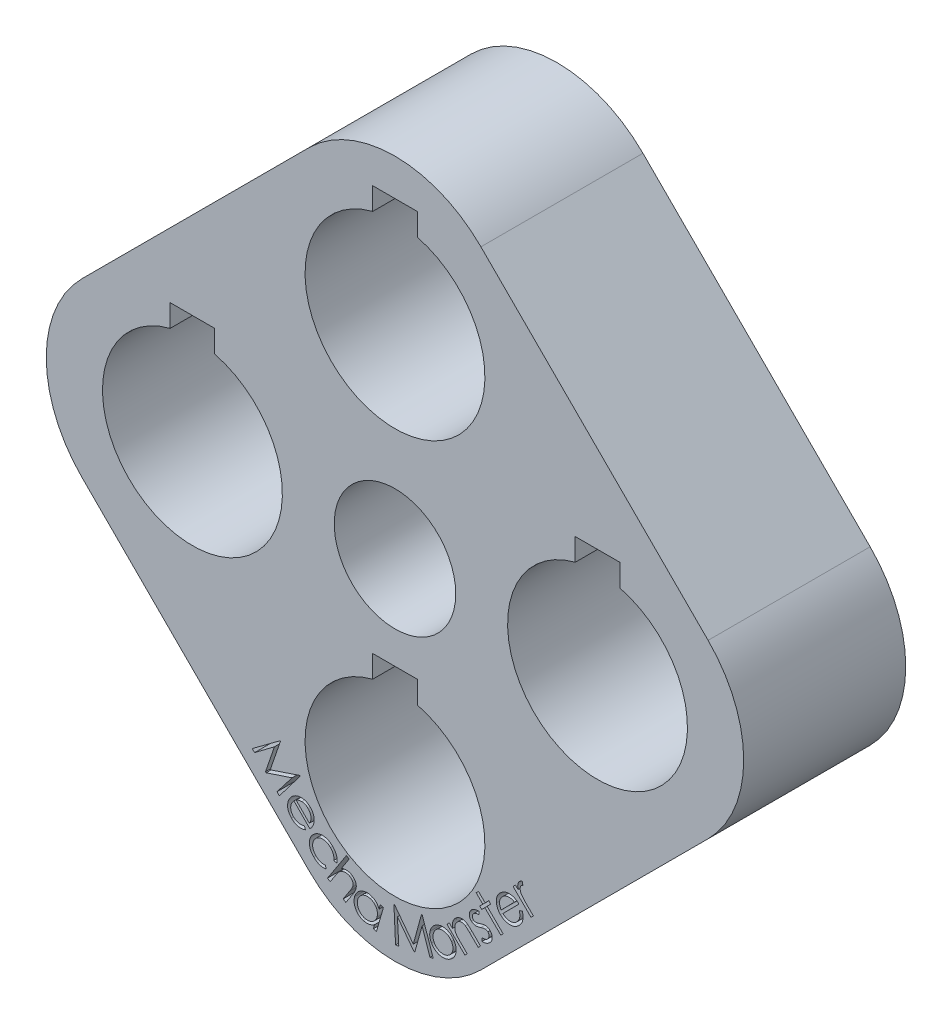
from build123d import *

# Parameters (mm, degrees)
SKETCH1_R           = 7.5
BOSS_EXTRUDE1_DEPTH = 20
FILLET1_R           = 15
CUT_EXTRUDE4_DEPTH  = 3


with BuildPart() as part:
    # Sketch1 → Boss-Extrude1 (new body)
    with BuildSketch(Plane.XY):
        Polygon((0, -24.255339059), (49.255339059, 25), (0, 74.255339059), (-49.255339059, 25), align=None)
        with Locations((0, 25)):
            Circle(SKETCH1_R, mode=Mode.SUBTRACT)
        with BuildLine():
            Line((-2.75, 13.503952762), (2.75, 13.503952762))
            Line((2.75, 13.503952762), (2.75, 10.753952762))
            ThreePointArc((2.75, 10.753952762), (0, -11.1), (-2.75, 10.753952762))
            Line((-2.75, 10.753952762), (-2.75, 13.503952762))
        make_face(mode=Mode.SUBTRACT)
        with BuildLine():
            Line((-2.75, 63.503952762), (2.75, 63.503952762))
            Line((2.75, 63.503952762), (2.75, 60.753952762))
            ThreePointArc((2.75, 60.753952762), (0, 38.9), (-2.75, 60.753952762))
            Line((-2.75, 60.753952762), (-2.75, 63.503952762))
        make_face(mode=Mode.SUBTRACT)
        with BuildLine():
            Line((22.25, 38.503952762), (27.75, 38.503952762))
            Line((27.75, 38.503952762), (27.75, 35.753952762))
            ThreePointArc((27.75, 35.753952762), (25, 13.9), (22.25, 35.753952762))
            Line((22.25, 35.753952762), (22.25, 38.503952762))
        make_face(mode=Mode.SUBTRACT)
        with BuildLine():
            Line((-27.75, 38.503952762), (-22.25, 38.503952762))
            Line((-22.25, 38.503952762), (-22.25, 35.753952762))
            ThreePointArc((-22.25, 35.753952762), (-25, 13.9), (-27.75, 35.753952762))
            Line((-27.75, 35.753952762), (-27.75, 38.503952762))
        make_face(mode=Mode.SUBTRACT)
    extrude(amount=BOSS_EXTRUDE1_DEPTH)

    # Fillet1
    fillet1_edges = [part.edges().sort_by_distance(p)[0] for p in [
        (49.255339059, 25, 10),
        (0, -24.255339059, 10),
        (-49.255339059, 25, 10),
        (0, 74.255339059, 10),
    ]]
    fillet(fillet1_edges, radius=FILLET1_R)

    # Sketch4 → Cut-Extrude4 (cut)
    # profile 1 of 12: a face of its own
    with BuildSketch(Plane.XY.offset(20)):
        with BuildLine():
            Line((14.57196407, -2.731870868), (14.861140085, -2.440150782))
            Line((14.861140085, -2.440150782), (15.185933087, -2.76155169))
            add(Edge.make_bspline(
                [(15.185933087, -2.76155169), (15.176864041, -2.709944276), (15.159352125, -2.610292703), (15.148158741, -2.464651139), (15.150912394, -2.329021108), (15.168497698, -2.203696367), (15.199934358, -2.088284076), (15.243886591, -1.982892846), (15.302035886, -1.887547489), (15.351239717, -1.833104568), (15.375890352, -1.805829201)],
                knots=[0, 0, 0, 0, 1.238328021, 2.391155128, 3.447473944, 4.439911283, 5.375446952, 6.267952662, 7.13226135, 8, 8, 8, 8], degree=3))
            add(Edge.make_bspline(
                [(15.375890352, -1.805829201), (15.396873142, -1.786818486), (15.44003116, -1.747716688), (15.516892742, -1.699561468), (15.604820904, -1.6587985), (15.668480419, -1.638357099), (15.701531378, -1.627744265)],
                knots=[0, 0, 0, 0, 0.904958139, 1.861344476, 2.889645698, 4, 4, 4, 4], degree=3))
            Line((15.701531378, -1.627744265), (15.795661987, -2.015291007))
            add(Edge.make_bspline(
                [(15.795661987, -2.015291007), (15.775770093, -2.023819438), (15.737980038, -2.04002151), (15.68608396, -2.066553583), (15.642938184, -2.095552625), (15.618784965, -2.117082418), (15.607400769, -2.127230109)],
                knots=[0, 0, 0, 0, 1.178648847, 2.239163524, 3.170060605, 4, 4, 4, 4], degree=3))
            add(Edge.make_bspline(
                [(15.607400769, -2.127230109), (15.585366617, -2.15243007), (15.540628807, -2.20359569), (15.49303485, -2.297659168), (15.463519927, -2.404506583), (15.450218985, -2.501105121), (15.450710494, -2.583555193), (15.455316134, -2.648910264), (15.467778152, -2.716329539), (15.485824506, -2.785582462), (15.508390511, -2.857307624), (15.538832047, -2.930283339), (15.574088797, -3.00577894), (15.601724663, -3.055689899), (15.615881004, -3.081256551)],
                knots=[0, 0, 0, 0, 1.172895077, 2.381428413, 3.664118173, 5.056485402, 5.791607531, 6.558850648, 7.35587122, 8.196754804, 9.073265227, 9.995638265, 10.973275174, 12, 12, 12, 12], degree=3))
            add(Edge.make_bspline(
                [(15.615881004, -3.081256551), (15.629527464, -3.103155664), (15.659686173, -3.151552753), (15.71412476, -3.227810687), (15.78373411, -3.313434675), (15.866722195, -3.409491318), (15.962689209, -3.516510671), (16.072280437, -3.633666673), (16.196148772, -3.760578027), (16.284006203, -3.847986883), (16.329916795, -3.893663068)],
                knots=[0, 0, 0, 0, 0.571285428, 1.262542128, 2.072931178, 3.013920869, 4.073308893, 5.255733602, 6.565962005, 8, 8, 8, 8], degree=3))
            Line((16.329916795, -3.893663068), (17.081265619, -4.637379682))
            Line((17.081265619, -4.637379682), (16.792089604, -4.929099767))
            Line((16.792089604, -4.929099767), (14.57196407, -2.731870868))
        make_face()
    # profile 2 of 12: a face of its own
    with BuildSketch(Plane.XY.offset(20)):
        with BuildLine():
            Line((15.342801074, -4.922237854), (15.707451181, -4.807754681))
            add(Edge.make_bspline(
                [(15.707451181, -4.807754681), (15.725102852, -4.86459139), (15.759369503, -4.974926767), (15.793281882, -5.140161787), (15.811571367, -5.298827496), (15.814270234, -5.451352583), (15.802308389, -5.598742733), (15.77647881, -5.741701144), (15.738688653, -5.881759353), (15.685272985, -6.017744938), (15.619301932, -6.15140057), (15.535418017, -6.280460789), (15.438474501, -6.408603754), (15.362850977, -6.487839239), (15.324144557, -6.528394371)],
                knots=[0, 0, 0, 0, 1.147063421, 2.226759362, 3.247046854, 4.222874512, 5.163510201, 6.093727941, 7.020698111, 7.956012273, 8.906701803, 9.889552677, 10.919808848, 12, 12, 12, 12], degree=3))
            add(Edge.make_bspline(
                [(15.324144557, -6.528394371), (15.279359014, -6.57132225), (15.191939666, -6.65511552), (15.051572122, -6.764441376), (14.906513847, -6.853908889), (14.758265613, -6.925794753), (14.606284541, -6.980051137), (14.449940547, -7.014957612), (14.289660216, -7.031182581), (14.127622769, -7.027884547), (13.96755241, -7.009549443), (13.811764146, -6.980738386), (13.662967225, -6.936932119), (13.520626454, -6.881487634), (13.383996759, -6.814796102), (13.255242069, -6.733334551), (13.13182852, -6.641158052), (13.056989411, -6.57016307), (13.019216673, -6.534330535)],
                knots=[0, 0, 0, 0, 1.154621885, 2.253769481, 3.305465943, 4.322436967, 5.316275864, 6.303359915, 7.297923306, 8.308623123, 9.314762543, 10.29542665, 11.254842703, 12.198067375, 13.13727433, 14.08071926, 15.031302072, 16, 16, 16, 16], degree=3))
            add(Edge.make_bspline(
                [(13.019216673, -6.534330535), (12.9851839, -6.499312082), (12.917744236, -6.429919186), (12.829210907, -6.316101974), (12.749517237, -6.198573027), (12.682681449, -6.074592281), (12.625366422, -5.946364725), (12.579544936, -5.812405858), (12.544267448, -5.673142749), (12.530215601, -5.577631861), (12.523122923, -5.529422683)],
                knots=[0, 0, 0, 0, 1.025246356, 2.031637833, 3.024905585, 4.005593486, 4.986712902, 5.972763272, 6.976751036, 8, 8, 8, 8], degree=3))
            add(Edge.make_bspline(
                [(12.523122923, -5.529422683), (12.517216945, -5.468427756), (12.505636057, -5.348824294), (12.51211521, -5.170596762), (12.537956074, -4.998517408), (12.585582097, -4.832488076), (12.651621303, -4.672112203), (12.73945432, -4.518542736), (12.846583478, -4.370776355), (12.931125815, -4.280541528), (12.974271427, -4.234490792)],
                knots=[0, 0, 0, 0, 1.032474824, 2.024554675, 2.998744837, 3.959973082, 4.930224934, 5.916458261, 6.936678512, 8, 8, 8, 8], degree=3))
            add(Edge.make_bspline(
                [(12.974271427, -4.234490792), (13.021094552, -4.189577763), (13.112880276, -4.101536331), (13.264244708, -3.990466239), (13.421112784, -3.898392715), (13.584938069, -3.827790439), (13.755048211, -3.776758128), (13.931767274, -3.748926557), (14.114743708, -3.738133708), (14.237867995, -3.748983334), (14.300580187, -3.754509488)],
                knots=[0, 0, 0, 0, 1.063125237, 2.084007013, 3.070791757, 4.040527219, 5.002797975, 5.975322074, 6.968749423, 8, 8, 8, 8], degree=3))
            add(Edge.make_bspline(
                [(14.300580187, -3.754509488), (14.345383992, -3.760782043), (14.435225611, -3.773359914), (14.567686377, -3.806662851), (14.696923357, -3.853234543), (14.824154846, -3.909899045), (14.948068516, -3.980072217), (15.069550008, -4.061868778), (15.188822155, -4.155192619), (15.26387338, -4.225150782), (15.302095946, -4.26077952)],
                knots=[0, 0, 0, 0, 0.949379018, 1.90371663, 2.861057541, 3.830645602, 4.824452431, 5.846650718, 6.903328567, 8, 8, 8, 8], degree=3))
            Line((15.302095946, -4.26077952), (13.327049205, -6.256178826))
            add(Edge.make_bspline(
                [(13.327049205, -6.256178826), (13.359913554, -6.286159814), (13.424578944, -6.345151771), (13.528331999, -6.422146826), (13.634562159, -6.48805087), (13.743783676, -6.541613532), (13.855171489, -6.584491698), (13.969691207, -6.615351488), (14.087119797, -6.633648932), (14.206076919, -6.641530069), (14.324233949, -6.637178438), (14.439560471, -6.621948563), (14.550718838, -6.595756784), (14.657825046, -6.55837272), (14.7596571, -6.508472797), (14.858074494, -6.448972551), (14.951788074, -6.377445584), (15.009194182, -6.322338346), (15.038360636, -6.294339884)],
                knots=[0, 0, 0, 0, 1.117684253, 2.19920645, 3.242444032, 4.25620018, 5.252573491, 6.238528758, 7.231526287, 8.235497616, 9.230958312, 10.198744758, 11.155327073, 12.096986603, 13.044073149, 14.000734639, 14.984228603, 16, 16, 16, 16], degree=3))
            add(Edge.make_bspline(
                [(15.038360636, -6.294339884), (15.065423242, -6.265372432), (15.119204751, -6.207805421), (15.191054305, -6.113922042), (15.252764065, -6.013108092), (15.306607944, -5.907920545), (15.351745759, -5.800427809), (15.384660364, -5.692006781), (15.407947807, -5.585144161), (15.420702807, -5.476058001), (15.419709128, -5.358969259), (15.407497044, -5.227908467), (15.381307449, -5.080131757), (15.356140767, -4.976936749), (15.342801074, -4.922237854)],
                knots=[0, 0, 0, 0, 0.962829226, 1.913430301, 2.86643511, 3.830953147, 4.782471826, 5.694941085, 6.579986032, 7.437059565, 8.357404625, 9.419476327, 10.632183882, 12, 12, 12, 12], degree=3))
        make_face()
        with BuildLine():
            add(Edge.make_bspline(
                [(14.744944504, -4.330317448), (14.698817566, -4.304127844), (14.610011008, -4.253705927), (14.473567277, -4.19748228), (14.343008828, -4.155946097), (14.215795339, -4.133739959), (14.0901298, -4.127365567), (13.963730838, -4.138219549), (13.835181167, -4.163872215), (13.706623632, -4.20471148), (13.58056932, -4.257910959), (13.462511716, -4.326945482), (13.350837683, -4.40610746), (13.284777994, -4.469105922), (13.251575113, -4.500770172)],
                knots=[0, 0, 0, 0, 1.169088622, 2.250804884, 3.248923354, 4.185992093, 5.091272184, 6.01723614, 6.977283851, 7.977251285, 8.988510715, 9.988633695, 10.989048259, 12, 12, 12, 12], degree=3))
            add(Edge.make_bspline(
                [(13.251575113, -4.500770172), (13.225525296, -4.527950725), (13.174180393, -4.58152434), (13.108545508, -4.670013278), (13.050042063, -4.76035796), (13.002652298, -4.855648163), (12.963003232, -4.953796569), (12.934867324, -5.056373639), (12.91328307, -5.161987442), (12.908170391, -5.234206502), (12.905581523, -5.270775514)],
                knots=[0, 0, 0, 0, 1.044877375, 2.059481962, 3.055066394, 4.031386489, 5.011331762, 5.990773466, 6.982603363, 8, 8, 8, 8], degree=3))
            add(Edge.make_bspline(
                [(12.905581523, -5.270775514), (12.905140531, -5.29792041), (12.904243283, -5.353149727), (12.911223973, -5.437185289), (12.926128215, -5.523236611), (12.947263734, -5.611741293), (12.976252384, -5.702400927), (13.012902161, -5.794986204), (13.057329728, -5.889301924), (13.091003665, -5.951890916), (13.10825914, -5.983963281)],
                knots=[0, 0, 0, 0, 0.86725268, 1.764522297, 2.689778832, 3.65606644, 4.670318369, 5.728864248, 6.836205956, 8, 8, 8, 8], degree=3))
            Line((13.10825914, -5.983963281), (14.744944504, -4.330317448))
        make_face(mode=Mode.SUBTRACT)
    # profile 3 of 12: a face of its own
    with BuildSketch(Plane.XY.offset(20)):
        Polygon((10.019349107, -5.686241718), (10.304285005, -5.398761751), (11.128563851, -6.214560362), (11.576320261, -5.76171581), (11.821399054, -6.004250533), (11.373642644, -6.457095084), (13.348689385, -8.411789261), (13.063753488, -8.699269229), (11.088706746, -6.744575052), (10.702856052, -7.134665864), (10.457777259, -6.892131142), (10.843627953, -6.50204033), align=None)
    # profile 4 of 12: a face of its own
    with BuildSketch(Plane.XY.offset(20)):
        with BuildLine():
            Line((10.34294506, -7.494520403), (10.350577271, -7.865954698))
            add(Edge.make_bspline(
                [(10.350577271, -7.865954698), (10.314358594, -7.867109032), (10.244272828, -7.869342752), (10.142797384, -7.881458288), (10.04849951, -7.899632828), (9.961547254, -7.925438855), (9.881302465, -7.956261654), (9.808666692, -7.99496827), (9.742469533, -8.039431131), (9.704495453, -8.075431761), (9.685726844, -8.093224998)],
                knots=[0, 0, 0, 0, 1.206787315, 2.335220918, 3.400918429, 4.402209249, 5.353581904, 6.259345843, 7.139685326, 8, 8, 8, 8], degree=3))
            add(Edge.make_bspline(
                [(9.685726844, -8.093224998), (9.66469777, -8.11681439), (9.623576952, -8.162941725), (9.578784198, -8.24383829), (9.550493722, -8.330769882), (9.538822619, -8.421380335), (9.543605337, -8.510885801), (9.564586301, -8.594454745), (9.602639767, -8.670184925), (9.63975786, -8.711614842), (9.658590092, -8.73263472)],
                knots=[0, 0, 0, 0, 1.067623281, 2.08765937, 3.104861333, 4.147424945, 5.163815705, 6.122768583, 7.047568077, 8, 8, 8, 8], degree=3))
            add(Edge.make_bspline(
                [(9.658590092, -8.73263472), (9.677520084, -8.74926606), (9.715609993, -8.782730745), (9.784589809, -8.819048811), (9.861590635, -8.84520797), (9.91674468, -8.852060172), (9.945222036, -8.855598128)],
                knots=[0, 0, 0, 0, 0.948021114, 1.907556956, 2.919621465, 4, 4, 4, 4], degree=3))
            add(Edge.make_bspline(
                [(9.945222036, -8.855598128), (9.961332934, -8.856434858), (9.996106331, -8.858240839), (10.051658315, -8.855068834), (10.113993425, -8.848389552), (10.182393587, -8.836113091), (10.257545493, -8.819664494), (10.339455376, -8.79967463), (10.427766451, -8.773758362), (10.488559254, -8.754516255), (10.520181972, -8.744507049)],
                knots=[0, 0, 0, 0, 0.657203644, 1.418493521, 2.264693755, 3.211878927, 4.249250734, 5.400665953, 6.647899009, 8, 8, 8, 8], degree=3))
            add(Edge.make_bspline(
                [(10.520181972, -8.744507049), (10.558823709, -8.7323491), (10.633770697, -8.708768337), (10.743858504, -8.679242237), (10.847347265, -8.655274324), (10.944098012, -8.637253972), (11.034100882, -8.625249799), (11.117353742, -8.618760334), (11.194237666, -8.619508093), (11.243003801, -8.624319322), (11.266442656, -8.626631782)],
                knots=[0, 0, 0, 0, 1.277291447, 2.477351027, 3.593110498, 4.626383207, 5.579453446, 6.455233306, 7.257526516, 8, 8, 8, 8], degree=3))
            add(Edge.make_bspline(
                [(11.266442656, -8.626631782), (11.309791854, -8.635456178), (11.395347029, -8.65287225), (11.516577122, -8.702530989), (11.628724068, -8.770649896), (11.69333763, -8.829847997), (11.726071395, -8.859838245)],
                knots=[0, 0, 0, 0, 1.011582062, 1.996486337, 2.985003393, 4, 4, 4, 4], degree=3))
            add(Edge.make_bspline(
                [(11.726071395, -8.859838245), (11.748090548, -8.88255493), (11.791340548, -8.927175021), (11.846270355, -9.001271728), (11.894470544, -9.077296686), (11.932644039, -9.157750277), (11.962377245, -9.241015792), (11.983872702, -9.327637946), (11.99642889, -9.417727055), (12.000449909, -9.51026241), (11.996641131, -9.603177109), (11.982804144, -9.694020093), (11.960916619, -9.782269303), (11.928982727, -9.867256616), (11.889395924, -9.950041857), (11.839329676, -10.028985208), (11.781772638, -10.106137164), (11.737028934, -10.153500348), (11.714199066, -10.177666771)],
                knots=[0, 0, 0, 0, 1.031653992, 2.026373895, 3.00447764, 3.966120837, 4.926346334, 5.886438814, 6.874287242, 7.890348589, 8.906409936, 9.904718429, 10.884952601, 11.8688282, 12.863419699, 13.874777422, 14.91563399, 16, 16, 16, 16], degree=3))
            add(Edge.make_bspline(
                [(11.714199066, -10.177666771), (11.681852998, -10.208496814), (11.617782614, -10.269564288), (11.508658992, -10.345995667), (11.392923643, -10.41183835), (11.269041433, -10.46289906), (11.141570914, -10.501416407), (11.012096889, -10.52422428), (10.881928652, -10.53283346), (10.795763668, -10.525595246), (10.752540412, -10.521964314)],
                knots=[0, 0, 0, 0, 1.013996944, 2.00850299, 3.017871975, 4.034144554, 5.046125739, 6.037661585, 7.01562501, 8, 8, 8, 8], degree=3))
            Line((10.752540412, -10.521964314), (10.726251684, -10.140353737))
            add(Edge.make_bspline(
                [(10.726251684, -10.140353737), (10.763569757, -10.141929423), (10.836008016, -10.144987993), (10.941499671, -10.137457856), (11.04039089, -10.123707924), (11.132487139, -10.100722811), (11.218194355, -10.069608511), (11.296174493, -10.028535683), (11.368043084, -9.979976092), (11.409943702, -9.941074837), (11.430959216, -9.921563673)],
                knots=[0, 0, 0, 0, 1.177229141, 2.285124103, 3.330439412, 4.323014027, 5.273697781, 6.19891235, 7.096653397, 8, 8, 8, 8], degree=3))
            add(Edge.make_bspline(
                [(11.430959216, -9.921563673), (11.456969258, -9.892759661), (11.507893658, -9.836365022), (11.564033138, -9.737831438), (11.598133257, -9.631499824), (11.612116462, -9.521418608), (11.607607998, -9.412764238), (11.583612013, -9.310984683), (11.53744769, -9.219385353), (11.492674298, -9.16931724), (11.469968297, -9.143926119)],
                knots=[0, 0, 0, 0, 1.07752162, 2.109652114, 3.126931904, 4.165902224, 5.18159974, 6.137300984, 7.055366514, 8, 8, 8, 8], degree=3))
            add(Edge.make_bspline(
                [(11.469968297, -9.143926119), (11.449147131, -9.124939519), (11.408051919, -9.087465234), (11.334880444, -9.046993949), (11.256314818, -9.017523114), (11.200551872, -9.010799401), (11.172312047, -9.007394335)],
                knots=[0, 0, 0, 0, 1.008379688, 1.990262008, 2.982215715, 4, 4, 4, 4], degree=3))
            add(Edge.make_bspline(
                [(11.172312047, -9.007394335), (11.15676367, -9.00686773), (11.12280822, -9.0057177), (11.06805608, -9.009493), (11.00551527, -9.018317616), (10.935454327, -9.03219584), (10.857428823, -9.050108296), (10.771656647, -9.072122124), (10.678353249, -9.0993517), (10.613973865, -9.120285873), (10.580391641, -9.131205767)],
                knots=[0, 0, 0, 0, 0.614214026, 1.341356318, 2.164063311, 3.107877244, 4.161541458, 5.326042368, 6.605183248, 8, 8, 8, 8], degree=3))
            add(Edge.make_bspline(
                [(10.580391641, -9.131205767), (10.543720692, -9.142767896), (10.472975241, -9.165073512), (10.368934088, -9.193345038), (10.271016181, -9.215356204), (10.179084922, -9.231736219), (10.093290641, -9.242281996), (10.013426537, -9.24618381), (9.939302476, -9.246620395), (9.892325056, -9.2402637), (9.869747944, -9.237208705)],
                knots=[0, 0, 0, 0, 1.273710877, 2.457238066, 3.570472953, 4.597371492, 5.549839157, 6.431347368, 7.246113434, 8, 8, 8, 8], degree=3))
            add(Edge.make_bspline(
                [(9.869747944, -9.237208705), (9.82781909, -9.228328675), (9.744525323, -9.210688052), (9.626094731, -9.161139588), (9.515715174, -9.092680015), (9.451374847, -9.033929937), (9.41859944, -9.004002241)],
                knots=[0, 0, 0, 0, 0.995146663, 1.976908624, 2.969423281, 4, 4, 4, 4], degree=3))
            add(Edge.make_bspline(
                [(9.41859944, -9.004002241), (9.398465658, -8.982829052), (9.359036871, -8.941364755), (9.306681553, -8.874842242), (9.26302757, -8.804951041), (9.228554081, -8.731820984), (9.201078727, -8.656657167), (9.181136852, -8.578881772), (9.170612713, -8.498059649), (9.166905103, -8.415431482), (9.172317302, -8.332523022), (9.184697511, -8.250900199), (9.205964841, -8.171505638), (9.236244031, -8.095237451), (9.272486297, -8.020639301), (9.318217763, -7.949124649), (9.371418607, -7.879449297), (9.412258102, -7.836205203), (9.43301584, -7.814225265)],
                knots=[0, 0, 0, 0, 1.052635399, 2.061417778, 3.045198048, 4.015808259, 4.969754627, 5.925983037, 6.902828667, 7.902048911, 8.902307307, 9.89218762, 10.873273971, 11.857054242, 12.845728055, 13.857592261, 14.911065412, 16, 16, 16, 16], degree=3))
            add(Edge.make_bspline(
                [(9.43301584, -7.814225265), (9.459288677, -7.78950568), (9.512205213, -7.739717576), (9.603449819, -7.676804189), (9.704028599, -7.623877631), (9.813236749, -7.578036395), (9.932725582, -7.544113386), (10.061151342, -7.518049659), (10.198845344, -7.499585705), (10.293981113, -7.496241553), (10.34294506, -7.494520403)],
                knots=[0, 0, 0, 0, 0.874863017, 1.762075387, 2.680101334, 3.630891775, 4.63206538, 5.689990357, 6.811097137, 8, 8, 8, 8], degree=3))
        make_face()
    # profile 5 of 12: a face of its own
    with BuildSketch(Plane.XY.offset(20)):
        with BuildLine():
            Line((6.417754747, -10.857363556), (6.700994598, -10.571579635))
            Line((6.700994598, -10.571579635), (7.098717621, -10.965062541))
            add(Edge.make_bspline(
                [(7.098717621, -10.965062541), (7.090918292, -10.900712912), (7.075699288, -10.77514605), (7.075123582, -10.590040528), (7.092674206, -10.414310546), (7.128605049, -10.247992342), (7.185488153, -10.091206421), (7.260359609, -9.943809857), (7.354088643, -9.805436848), (7.430024424, -9.723481138), (7.468455869, -9.682002979)],
                knots=[0, 0, 0, 0, 1.120333253, 2.186131188, 3.193606679, 4.169851435, 5.120933663, 6.069852165, 7.023143355, 8, 8, 8, 8], degree=3))
            add(Edge.make_bspline(
                [(7.468455869, -9.682002979), (7.510021261, -9.642751263), (7.59127391, -9.56602142), (7.73035134, -9.475861143), (7.876453574, -9.406665253), (8.030559399, -9.361967398), (8.188197002, -9.340057973), (8.346385207, -9.340063111), (8.502833057, -9.366789406), (8.63152078, -9.407297846), (8.736145032, -9.452946499), (8.81880172, -9.499573284), (8.906923324, -9.555175849), (8.999609228, -9.620990134), (9.096367387, -9.698107989), (9.198074052, -9.784458516), (9.304141371, -9.881490244), (9.375280683, -9.950632625), (9.412125741, -9.986443417)],
                knots=[0, 0, 0, 0, 1.222189183, 2.389153704, 3.532064333, 4.673836005, 5.810814823, 6.93080807, 8.047491357, 9.196303167, 9.811603985, 10.488995099, 11.226332848, 12.042693459, 12.9219941, 13.875444691, 14.899632809, 16, 16, 16, 16], degree=3))
            Line((9.412125741, -9.986443417), (10.555261425, -11.117706772))
            Line((10.555261425, -11.117706772), (10.273717621, -11.401794646))
            Line((10.273717621, -11.401794646), (9.214536265, -10.353637594))
            add(Edge.make_bspline(
                [(9.214536265, -10.353637594), (9.183853316, -10.32325809), (9.125178569, -10.265163618), (9.039186859, -10.184114449), (8.961567948, -10.110712498), (8.890005316, -10.04716632), (8.82599685, -9.991746432), (8.768047109, -9.945968616), (8.717826856, -9.908264409), (8.685488317, -9.887898323), (8.670953198, -9.878744432)],
                knots=[0, 0, 0, 0, 1.433149307, 2.740599442, 3.922240737, 4.978841257, 5.917171647, 6.731912966, 7.430036228, 8, 8, 8, 8], degree=3))
            add(Edge.make_bspline(
                [(8.670953198, -9.878744432), (8.626983809, -9.853585478), (8.542369548, -9.805169833), (8.408757956, -9.757837462), (8.277497328, -9.735834519), (8.148861744, -9.738101625), (8.0228645, -9.765384377), (7.901637481, -9.820686873), (7.782199332, -9.896990945), (7.711349651, -9.964220999), (7.674525581, -9.99916377)],
                knots=[0, 0, 0, 0, 1.104810284, 2.126086052, 3.077165424, 3.997299944, 4.920123408, 5.871122615, 6.893517549, 8, 8, 8, 8], degree=3))
            add(Edge.make_bspline(
                [(7.674525581, -9.99916377), (7.654116225, -10.021195845), (7.613837411, -10.064677173), (7.559548828, -10.134910777), (7.513584437, -10.209494398), (7.472772259, -10.287009472), (7.44115933, -10.368620134), (7.415061293, -10.453548599), (7.39696772, -10.542178124), (7.384726467, -10.633423851), (7.381226893, -10.725600031), (7.38213198, -10.816893868), (7.39185136, -10.906490335), (7.408028782, -10.994058332), (7.430463372, -11.080006963), (7.46213371, -11.163314865), (7.497513043, -11.24607495), (7.527829803, -11.298333581), (7.543081938, -11.324624507)],
                knots=[0, 0, 0, 0, 1.006425399, 1.986227406, 2.969505195, 3.939962169, 4.918251108, 5.898419567, 6.914919457, 7.946803473, 8.980686677, 10.004184095, 11.004525074, 11.996936727, 12.987537407, 13.976777683, 14.982132037, 16, 16, 16, 16], degree=3))
            add(Edge.make_bspline(
                [(7.543081938, -11.324624507), (7.555075321, -11.342827483), (7.581192815, -11.38246735), (7.627424349, -11.444369948), (7.683367601, -11.513475355), (7.748770394, -11.590011873), (7.824690902, -11.673042645), (7.910085927, -11.763494591), (8.005358132, -11.861031334), (8.072191971, -11.928190887), (8.107017568, -11.963186206)],
                knots=[0, 0, 0, 0, 0.612958585, 1.334814521, 2.171621094, 3.113225669, 4.165633851, 5.335359877, 6.611516519, 8, 8, 8, 8], degree=3))
            Line((8.107017568, -11.963186206), (8.921120132, -12.768808535))
            Line((8.921120132, -12.768808535), (8.637880282, -13.054592456))
            Line((8.637880282, -13.054592456), (6.417754747, -10.857363556))
        make_face()
    # profile 6 of 12: a face of its own
    with BuildSketch(Plane.XY.offset(20)):
        with BuildLine():
            add(Edge.make_bspline(
                [(5.106115045, -11.594618491), (5.157887188, -11.566946109), (5.259742967, -11.512503859), (5.419232491, -11.45094238), (5.579636898, -11.406144556), (5.741712932, -11.379422969), (5.905330664, -11.372003889), (6.070141099, -11.38254845), (6.236367079, -11.410006459), (6.345088607, -11.442476073), (6.400198912, -11.45893473)],
                knots=[0, 0, 0, 0, 1.049040807, 2.063867947, 3.04995724, 4.023172464, 4.994863424, 5.972428058, 6.972235678, 8, 8, 8, 8], degree=3))
            add(Edge.make_bspline(
                [(6.400198912, -11.45893473), (6.449733225, -11.476724748), (6.547720903, -11.511916566), (6.68727763, -11.579344332), (6.817474494, -11.658495314), (6.938812388, -11.748977793), (7.050960825, -11.850980193), (7.154025947, -11.964734982), (7.248821864, -12.089306946), (7.303043999, -12.17977211), (7.330480696, -12.225547978)],
                knots=[0, 0, 0, 0, 1.022889494, 2.023457301, 3.007600156, 3.981590734, 4.962135249, 5.950444325, 6.96291362, 8, 8, 8, 8], degree=3))
            add(Edge.make_bspline(
                [(7.330480696, -12.225547978), (7.355707561, -12.272882677), (7.40558933, -12.36647887), (7.463768076, -12.513273779), (7.508530231, -12.662108283), (7.537408673, -12.813864687), (7.551055768, -12.967841161), (7.548995774, -13.124302842), (7.532593135, -13.283168518), (7.502620783, -13.443137117), (7.45739564, -13.5998247), (7.396941244, -13.749064962), (7.322140962, -13.889334426), (7.231409063, -14.019230886), (7.127477083, -14.140939647), (7.007419605, -14.252143193), (6.87379356, -14.355359403), (6.775668392, -14.414132295), (6.725839938, -14.443977465)],
                knots=[0, 0, 0, 0, 1.003680737, 1.984605333, 2.950912066, 3.910103824, 4.871877018, 5.840558258, 6.835449671, 7.859017057, 8.884170734, 9.883781827, 10.86891015, 11.854109568, 12.845022473, 13.859862346, 14.913227319, 16, 16, 16, 16], degree=3))
            add(Edge.make_bspline(
                [(6.725839938, -14.443977465), (6.67430016, -14.471520164), (6.573290336, -14.525499502), (6.416248228, -14.588620503), (6.258746576, -14.633687992), (6.10080975, -14.662403495), (5.942340114, -14.672350822), (5.783461852, -14.665436367), (5.624151187, -14.641787106), (5.466563688, -14.599716126), (5.313771419, -14.544281559), (5.16854222, -14.477146558), (5.033151428, -14.398220561), (4.908068093, -14.307056036), (4.792947208, -14.204618221), (4.687331257, -14.091108156), (4.590512767, -13.966375795), (4.535901764, -13.875274543), (4.508258474, -13.829160425)],
                knots=[0, 0, 0, 0, 1.092770315, 2.141657197, 3.159441972, 4.153310858, 5.139069392, 6.12369226, 7.123719622, 8.146111021, 9.170006039, 10.161437501, 11.135636252, 12.097235082, 13.052515552, 14.014216185, 14.994825337, 16, 16, 16, 16], degree=3))
            add(Edge.make_bspline(
                [(4.508258474, -13.829160425), (4.48302353, -13.78239809), (4.433141204, -13.689962221), (4.375309241, -13.545316959), (4.330120252, -13.39909679), (4.301118052, -13.250675369), (4.284014956, -13.100305002), (4.284195232, -12.948107241), (4.295951702, -12.79382347), (4.315864425, -12.691813475), (4.325933421, -12.640231472)],
                knots=[0, 0, 0, 0, 1.034996016, 2.04589352, 3.03068677, 4.014014611, 4.989391197, 5.975678461, 6.976388933, 8, 8, 8, 8], degree=3))
            add(Edge.make_bspline(
                [(4.325933421, -12.640231472), (4.340073081, -12.584209707), (4.367929425, -12.473842021), (4.428590273, -12.316136908), (4.504930894, -12.169284579), (4.594711292, -12.031876078), (4.70065422, -11.90582454), (4.821668225, -11.79075802), (4.956327574, -11.684686014), (5.055665134, -11.624954129), (5.106115045, -11.594618491)],
                knots=[0, 0, 0, 0, 1.029798521, 2.028791469, 3.005126059, 3.976920505, 4.950322076, 5.934448228, 6.95098187, 8, 8, 8, 8], degree=3))
        make_face()
        with BuildLine():
            add(Edge.make_bspline(
                [(5.300312427, -11.93552394), (5.265311123, -11.956534152), (5.196093422, -11.99808342), (5.102375232, -12.072873234), (5.016300577, -12.15325492), (4.941497301, -12.243566019), (4.875073509, -12.340954676), (4.818830009, -12.446769459), (4.773380605, -12.560502388), (4.736197886, -12.679747866), (4.709795294, -12.802347457), (4.696712111, -12.925368333), (4.693034512, -13.047253749), (4.705159686, -13.167866446), (4.726513562, -13.287414326), (4.762270624, -13.404982248), (4.808421056, -13.521702093), (4.848408558, -13.596312973), (4.868668463, -13.634115019)],
                knots=[0, 0, 0, 0, 1.004810122, 1.987087294, 2.94776783, 3.901963028, 4.869787391, 5.848155331, 6.847931933, 7.883342985, 8.922892097, 9.93201385, 10.92821777, 11.921373585, 12.913136354, 13.915819993, 14.944037828, 16, 16, 16, 16], degree=3))
            add(Edge.make_bspline(
                [(4.868668463, -13.634115019), (4.897698695, -13.681332508), (4.955335509, -13.775078425), (5.062888235, -13.8999155), (5.184106494, -14.010714249), (5.319551793, -14.103801384), (5.463416505, -14.180467646), (5.614468331, -14.235406505), (5.769716331, -14.268556283), (5.928069886, -14.280698004), (6.086388597, -14.270205024), (6.241931898, -14.239315104), (6.394187152, -14.188690191), (6.489292143, -14.138653075), (6.53757872, -14.113248299)],
                knots=[0, 0, 0, 0, 1.030133552, 2.045233975, 3.054469601, 4.078891969, 5.095449901, 6.080638615, 7.059811648, 8.041059816, 9.026824216, 10.002812478, 10.985990672, 12, 12, 12, 12], degree=3))
            add(Edge.make_bspline(
                [(6.53757872, -14.113248299), (6.583940776, -14.084775693), (6.675641549, -14.028458951), (6.797221571, -13.923559947), (6.903528801, -13.80577511), (6.9925376, -13.674700064), (7.06429177, -13.533365851), (7.114372133, -13.382666356), (7.144310064, -13.224950969), (7.153072767, -13.062221834), (7.142619706, -12.897988517), (7.109853115, -12.737075333), (7.057613287, -12.580699752), (7.006759067, -12.483310267), (6.981095013, -12.43416176)],
                knots=[0, 0, 0, 0, 1.011361377, 2.000399217, 2.976575123, 3.957292361, 4.940884782, 5.91758522, 6.90308977, 7.920237888, 8.94328886, 9.957643266, 10.969305712, 12, 12, 12, 12], degree=3))
            add(Edge.make_bspline(
                [(6.981095013, -12.43416176), (6.95886157, -12.397262701), (6.915171011, -12.324752986), (6.838904052, -12.224572727), (6.754873305, -12.135101701), (6.664528183, -12.053956474), (6.565457103, -11.984765912), (6.459716382, -11.924042196), (6.346487093, -11.872936083), (6.227047724, -11.832931364), (6.105309079, -11.803409325), (5.984121503, -11.78532057), (5.86479281, -11.778960445), (5.747405045, -11.785953292), (5.632035233, -11.804729652), (5.518577636, -11.835434857), (5.407041566, -11.878548866), (5.336136769, -11.916399879), (5.300312427, -11.93552394)],
                knots=[0, 0, 0, 0, 1.061197607, 2.085341394, 3.095816118, 4.082842759, 5.07252125, 6.067994319, 7.084503211, 8.128780321, 9.167978934, 10.168024666, 11.144595562, 12.107628557, 13.060553816, 14.02048224, 14.999857205, 16, 16, 16, 16], degree=3))
        make_face(mode=Mode.SUBTRACT)
    # profile 7 of 12: a face of its own
    with BuildSketch(Plane.XY.offset(20)):
        Polygon((0.0693975, -16.245979043), (-0.13158407, -12.001621404), (-0.06374219, -11.988901051), (2.262386282, -15.058746137), (3.279166464, -11.352035399), (3.346160321, -11.339315047), (4.726742586, -15.358098434), (4.319691304, -15.436116596), (3.352096485, -12.557924822), (2.454039594, -15.791438444), (2.350580727, -15.810942985), (0.302603964, -13.115924288), (0.467968547, -16.170504951), align=None)
    # profile 8 of 12: a face of its own
    with BuildSketch(Plane.XY.offset(20)):
        with BuildLine():
            Line((-1.4296615, -12.998981684), (-2.289557333, -15.997592795))
            Line((-2.289557333, -15.997592795), (-2.669471863, -15.889045786))
            Line((-2.669471863, -15.889045786), (-2.521915773, -15.373447496))
            add(Edge.make_bspline(
                [(-2.521915773, -15.373447496), (-2.576081444, -15.408789591), (-2.682055051, -15.477935403), (-2.849876186, -15.560695101), (-3.019909311, -15.622940758), (-3.192211723, -15.66523683), (-3.366547948, -15.685582738), (-3.542599961, -15.6851841), (-3.720795445, -15.66581035), (-3.837492101, -15.635543086), (-3.896561874, -15.620222335)],
                knots=[0, 0, 0, 0, 1.072480514, 2.09827786, 3.096948197, 4.071940274, 5.035434548, 6.001710791, 6.988501535, 8, 8, 8, 8], degree=3))
            add(Edge.make_bspline(
                [(-3.896561874, -15.620222335), (-3.948426589, -15.604106439), (-4.050717153, -15.572321746), (-4.195047229, -15.505738928), (-4.330091754, -15.428685947), (-4.455029195, -15.338063997), (-4.5693407, -15.233864483), (-4.675748927, -15.118459426), (-4.769221749, -14.988249169), (-4.854136545, -14.848747194), (-4.924193848, -14.7006432), (-4.980890009, -14.549339148), (-5.021297496, -14.395367415), (-5.044667555, -14.239000845), (-5.053546738, -14.08051163), (-5.04542077, -13.920051019), (-5.022098717, -13.757166196), (-4.993849075, -13.649749376), (-4.979487889, -13.595142207)],
                knots=[0, 0, 0, 0, 1.019152748, 2.01003147, 2.97811575, 3.936056919, 4.902159031, 5.879329694, 6.878650499, 7.907589584, 8.943028735, 9.950986629, 10.938730913, 11.926917469, 12.915902468, 13.915223273, 14.940168276, 16, 16, 16, 16], degree=3))
            add(Edge.make_bspline(
                [(-4.979487889, -13.595142207), (-4.962961499, -13.542487877), (-4.930318393, -13.438484471), (-4.864642784, -13.290672382), (-4.785929004, -13.153274519), (-4.695659525, -13.02523251), (-4.592988263, -12.906806203), (-4.47638438, -12.799538146), (-4.348065608, -12.701858277), (-4.208843299, -12.615219088), (-4.062826482, -12.541086029), (-3.912941585, -12.482096676), (-3.761245375, -12.439326599), (-3.608062137, -12.412936181), (-3.453135347, -12.40252728), (-3.296977618, -12.409132112), (-3.138431963, -12.429451469), (-3.034445025, -12.456767007), (-2.981544513, -12.470663041)],
                knots=[0, 0, 0, 0, 1.03866782, 2.051587987, 3.038720499, 4.016492813, 4.997534746, 5.984480638, 6.994893728, 8.030350736, 9.068349887, 10.074702058, 11.058945165, 12.031267971, 12.996922739, 13.977141062, 14.970925824, 16, 16, 16, 16], degree=3))
            add(Edge.make_bspline(
                [(-2.981544513, -12.470663041), (-2.921978534, -12.490000825), (-2.804885017, -12.528014626), (-2.640090427, -12.606465554), (-2.490452093, -12.703141808), (-2.355329375, -12.816781783), (-2.234984906, -12.947711373), (-2.129158871, -13.095632451), (-2.038597386, -13.261244684), (-1.992003699, -13.380575064), (-1.968156425, -13.441649953)],
                knots=[0, 0, 0, 0, 1.027427124, 2.019694099, 2.986464884, 3.944945793, 4.910557379, 5.898386314, 6.924365928, 8, 8, 8, 8], degree=3))
            Line((-1.968156425, -13.441649953), (-1.80957603, -12.890434675))
            Line((-1.80957603, -12.890434675), (-1.4296615, -12.998981684))
        make_face()
        with BuildLine():
            add(Edge.make_bspline(
                [(-3.057866628, -12.852273618), (-3.111295274, -12.838858583), (-3.21680421, -12.812367064), (-3.379146791, -12.799766215), (-3.540428046, -12.807243867), (-3.699962, -12.835995822), (-3.854145153, -12.886170048), (-4.001043256, -12.955981415), (-4.13731273, -13.048066591), (-4.262638257, -13.15770196), (-4.374394201, -13.281614668), (-4.468219802, -13.417593676), (-4.544757143, -13.56336606), (-4.578419787, -13.667487102), (-4.595333241, -13.719801662)],
                knots=[0, 0, 0, 0, 1.009467402, 1.993459309, 2.975055123, 3.966173402, 4.958716238, 5.942544028, 6.94108824, 7.966912548, 8.991844469, 9.994852733, 10.992534108, 12, 12, 12, 12], degree=3))
            add(Edge.make_bspline(
                [(-4.595333241, -13.719801662), (-4.60838962, -13.772676833), (-4.634519118, -13.878494966), (-4.647316356, -14.042531484), (-4.638193312, -14.208505582), (-4.609791627, -14.374341465), (-4.561092141, -14.535438137), (-4.49302066, -14.686602923), (-4.406197998, -14.825696231), (-4.302360593, -14.951683821), (-4.182891824, -15.061925796), (-4.051030057, -15.153731268), (-3.909558271, -15.229800625), (-3.807852156, -15.262733515), (-3.756637995, -15.279316887)],
                knots=[0, 0, 0, 0, 0.997585267, 1.996449532, 3.003567686, 4.040003476, 5.074882081, 6.08190682, 7.071647612, 8.073333344, 9.067626063, 10.042798477, 11.014450276, 12, 12, 12, 12], degree=3))
            add(Edge.make_bspline(
                [(-3.756637995, -15.279316887), (-3.703760356, -15.292413783), (-3.598484974, -15.318488713), (-3.435949163, -15.330708378), (-3.272382526, -15.324533006), (-3.109652895, -15.295366164), (-2.952199057, -15.246541712), (-2.80371033, -15.17977131), (-2.668559188, -15.091880306), (-2.546022373, -14.986490872), (-2.438378094, -14.86417521), (-2.34689374, -14.727054784), (-2.27206457, -14.575991552), (-2.237570338, -14.467724154), (-2.220019406, -14.412636865)],
                knots=[0, 0, 0, 0, 0.995138168, 1.981244841, 2.969911373, 3.983425333, 4.995988801, 5.979569742, 6.952185051, 7.93497707, 8.927962712, 9.923423358, 10.943421747, 12, 12, 12, 12], degree=3))
            add(Edge.make_bspline(
                [(-2.220019406, -14.412636865), (-2.208692069, -14.369856612), (-2.186387393, -14.285617958), (-2.168391104, -14.158198507), (-2.161221965, -14.033068499), (-2.166010408, -13.910277018), (-2.184031256, -13.789461073), (-2.214850564, -13.671364566), (-2.257445204, -13.555473575), (-2.311804222, -13.443261044), (-2.375227371, -13.336323454), (-2.448664417, -13.238033253), (-2.530451847, -13.149935419), (-2.619200719, -13.069798245), (-2.716968424, -13.000400663), (-2.823099194, -12.940780374), (-2.93696594, -12.890315001), (-3.017168233, -12.865079361), (-3.057866628, -12.852273618)],
                knots=[0, 0, 0, 0, 1.073532471, 2.113894244, 3.117297325, 4.113186642, 5.091447785, 6.076783705, 7.071135042, 8.083997238, 9.099645217, 10.085076717, 11.056332764, 12.013744581, 12.982986402, 13.960139743, 14.964879492, 16, 16, 16, 16], degree=3))
        make_face(mode=Mode.SUBTRACT)
    # profile 9 of 12: a face of its own
    with BuildSketch(Plane.XY.offset(20)):
        with BuildLine():
            Line((-5.984289968, -9.703010477), (-5.650168708, -9.920952517))
            Line((-5.650168708, -9.920952517), (-6.605891197, -11.387185156))
            add(Edge.make_bspline(
                [(-6.605891197, -11.387185156), (-6.544345035, -11.36669174), (-6.424687139, -11.326848489), (-6.244062906, -11.289735082), (-6.069516486, -11.271837228), (-5.900677707, -11.275252362), (-5.73743777, -11.298043524), (-5.580101772, -11.340783107), (-5.428059802, -11.403592967), (-5.33402041, -11.460804479), (-5.286366624, -11.489796)],
                knots=[0, 0, 0, 0, 1.131466175, 2.199793748, 3.211182194, 4.188339382, 5.140127921, 6.080930899, 7.027525552, 8, 8, 8, 8], degree=3))
            add(Edge.make_bspline(
                [(-5.286366624, -11.489796), (-5.24002118, -11.522058229), (-5.149301881, -11.585210214), (-5.033919743, -11.702216261), (-4.937698049, -11.830960971), (-4.863361032, -11.97231231), (-4.809639184, -12.120934896), (-4.77954506, -12.274853832), (-4.773123111, -12.431678397), (-4.786043484, -12.564931126), (-4.811234579, -12.675013689), (-4.838366261, -12.764960717), (-4.875611434, -12.861274653), (-4.921382556, -12.964181397), (-4.975954938, -13.073976016), (-5.039841434, -13.190100616), (-5.112780183, -13.313152399), (-5.166240857, -13.396322263), (-5.193932062, -13.439402037)],
                knots=[0, 0, 0, 0, 1.21675073, 2.381739482, 3.528933726, 4.675397454, 5.816081818, 6.929025678, 8.046760148, 9.193710938, 9.806591014, 10.482235444, 11.21999857, 12.034108341, 12.912819072, 13.865866417, 14.894575664, 16, 16, 16, 16], degree=3))
            Line((-5.193932062, -13.439402037), (-6.064852201, -14.775039056))
            Line((-6.064852201, -14.775039056), (-6.398973462, -14.557097015))
            Line((-6.398973462, -14.557097015), (-5.591655086, -13.318982699))
            add(Edge.make_bspline(
                [(-5.591655086, -13.318982699), (-5.568351001, -13.283162931), (-5.523787914, -13.21466681), (-5.461886738, -13.115249902), (-5.407051914, -13.024619235), (-5.357961303, -12.943228522), (-5.317613081, -12.86976731), (-5.284019206, -12.804834811), (-5.257684471, -12.74852649), (-5.243549821, -12.713267768), (-5.237181261, -12.69738147)],
                knots=[0, 0, 0, 0, 1.431097708, 2.736607393, 3.921796353, 4.978720494, 5.9193579, 6.728025139, 7.426894382, 8, 8, 8, 8], degree=3))
            add(Edge.make_bspline(
                [(-5.237181261, -12.69738147), (-5.222232909, -12.649391478), (-5.193524784, -12.557227291), (-5.174053119, -12.418122113), (-5.178722452, -12.286250074), (-5.207013547, -12.161852633), (-5.258927252, -12.045043904), (-5.335335503, -11.937339552), (-5.434179707, -11.837503119), (-5.513215901, -11.782271072), (-5.554342052, -11.75353131)],
                knots=[0, 0, 0, 0, 1.106675506, 2.125356641, 3.079426445, 3.999944176, 4.920461907, 5.878085812, 6.8958709, 8, 8, 8, 8], degree=3))
            add(Edge.make_bspline(
                [(-5.554342052, -11.75353131), (-5.579505515, -11.737777751), (-5.629438751, -11.706517101), (-5.708840383, -11.668490116), (-5.790296653, -11.637883597), (-5.873745866, -11.614882066), (-5.959174024, -11.599492935), (-6.046879614, -11.591941658), (-6.136813763, -11.592005825), (-6.227806404, -11.599764531), (-6.318153563, -11.614235859), (-6.406086451, -11.634316054), (-6.490939042, -11.660780785), (-6.572636781, -11.693958741), (-6.650980392, -11.733766774), (-6.726514719, -11.779160512), (-6.798929332, -11.830643575), (-6.843673458, -11.870145414), (-6.866234413, -11.890063094)],
                knots=[0, 0, 0, 0, 1.004243581, 1.992775508, 2.973777246, 3.946390797, 4.918580683, 5.907853222, 6.92207508, 7.959015042, 8.99564595, 10.016884238, 11.009482693, 12.000927581, 12.997943332, 13.980856312, 14.981904129, 16, 16, 16, 16], degree=3))
            add(Edge.make_bspline(
                [(-6.866234413, -11.890063094), (-6.881719614, -11.905118397), (-6.915307262, -11.937773586), (-6.964857588, -11.995674159), (-7.020936505, -12.06321588), (-7.081784159, -12.142309404), (-7.147846717, -12.23228529), (-7.219268295, -12.333383502), (-7.295059004, -12.44598532), (-7.347129342, -12.524906853), (-7.374200492, -12.565937827)],
                knots=[0, 0, 0, 0, 0.611721874, 1.326834445, 2.157585018, 3.099698981, 4.153889719, 5.320665056, 6.607024986, 8, 8, 8, 8], degree=3))
            Line((-7.374200492, -12.565937827), (-7.994105674, -13.517420199))
            Line((-7.994105674, -13.517420199), (-8.328226934, -13.299478158))
            Line((-8.328226934, -13.299478158), (-5.984289968, -9.703010477))
        make_face()
    # profile 10 of 12: a face of its own
    with BuildSketch(Plane.XY.offset(20)):
        with BuildLine():
            Line((-7.189839219, -11.117024727), (-7.554489326, -11.029678306))
            add(Edge.make_bspline(
                [(-7.554489326, -11.029678306), (-7.548178335, -10.974072903), (-7.535773197, -10.864772684), (-7.538387881, -10.701842408), (-7.56044894, -10.543983306), (-7.602359644, -10.392027605), (-7.662388891, -10.244927929), (-7.741962752, -10.104001858), (-7.839981702, -9.967840141), (-7.917605137, -9.884873289), (-7.957300491, -9.8424454)],
                knots=[0, 0, 0, 0, 1.029706477, 2.024032497, 2.991313679, 3.957333537, 4.919122949, 5.909558336, 6.930982378, 8, 8, 8, 8], degree=3))
            add(Edge.make_bspline(
                [(-7.957300491, -9.8424454), (-7.990986136, -9.810206548), (-8.057122941, -9.74691031), (-8.163615076, -9.663347226), (-8.274499637, -9.592583634), (-8.389097661, -9.533774073), (-8.507813001, -9.487441529), (-8.630732196, -9.45454195), (-8.757355249, -9.433047376), (-8.88634699, -9.425055403), (-9.014656004, -9.428194652), (-9.139676959, -9.443305473), (-9.260152983, -9.470618675), (-9.375886227, -9.509662375), (-9.486800425, -9.560796451), (-9.592459554, -9.624349706), (-9.694126787, -9.698744709), (-9.755975722, -9.756959162), (-9.787335213, -9.786475849)],
                knots=[0, 0, 0, 0, 1.095359386, 2.150576884, 3.175237535, 4.182455971, 5.173128371, 6.164246176, 7.167952989, 8.186565588, 9.196715617, 10.180593017, 11.141136548, 12.094924939, 13.046118488, 14.005443623, 14.988692807, 16, 16, 16, 16], degree=3))
            add(Edge.make_bspline(
                [(-9.787335213, -9.786475849), (-9.825793008, -9.827639465), (-9.902081859, -9.90929586), (-9.996210087, -10.0486394), (-10.069900141, -10.200305655), (-10.125968883, -10.360959372), (-10.159746879, -10.527834032), (-10.171388509, -10.696466559), (-10.158061541, -10.864808699), (-10.122563555, -11.031506638), (-10.063422752, -11.193387664), (-9.984240495, -11.349119242), (-9.882693019, -11.496143914), (-9.800909067, -11.58438904), (-9.759350437, -11.629230924)],
                knots=[0, 0, 0, 0, 0.985708687, 1.955353447, 2.931977874, 3.932647832, 4.928060121, 5.905688325, 6.88401856, 7.876606314, 8.88222609, 9.894298952, 10.929985075, 12, 12, 12, 12], degree=3))
            add(Edge.make_bspline(
                [(-9.759350437, -11.629230924), (-9.718661951, -11.66812711), (-9.638735683, -11.744532682), (-9.505804154, -11.840051049), (-9.368136371, -11.92046501), (-9.222389907, -11.980573052), (-9.07057409, -12.024440619), (-8.911985176, -12.049450907), (-8.746940841, -12.057750154), (-8.635680633, -12.048589389), (-8.578901719, -12.043914417)],
                knots=[0, 0, 0, 0, 1.040125821, 2.043167074, 3.019953123, 3.983321996, 4.951560546, 5.936750559, 6.947071344, 8, 8, 8, 8], degree=3))
            Line((-8.578901719, -12.043914417), (-8.503427627, -12.417044759))
            add(Edge.make_bspline(
                [(-8.503427627, -12.417044759), (-8.569405967, -12.427471433), (-8.700549742, -12.448196315), (-8.900769494, -12.444668815), (-9.100721431, -12.417111507), (-9.265444769, -12.37005941), (-9.395300353, -12.319476261), (-9.491983, -12.275541342), (-9.586736121, -12.224948804), (-9.679980744, -12.168571131), (-9.770682439, -12.104091274), (-9.860833717, -12.035093666), (-9.94816166, -11.958397681), (-10.004110604, -11.90368418), (-10.032414005, -11.876005763)],
                knots=[0, 0, 0, 0, 1.419683413, 2.821875244, 4.243967137, 5.707064877, 6.455811745, 7.209836039, 7.966305747, 8.741384116, 9.527711049, 10.334181908, 11.157297447, 12, 12, 12, 12], degree=3))
            add(Edge.make_bspline(
                [(-10.032414005, -11.876005763), (-10.073905512, -11.832032462), (-10.155537343, -11.745517862), (-10.262425311, -11.606167569), (-10.35303093, -11.461801355), (-10.428064197, -11.313151519), (-10.487123605, -11.159508161), (-10.529551207, -11.001177098), (-10.556077775, -10.83808751), (-10.565596644, -10.672214926), (-10.561260045, -10.506896699), (-10.539555021, -10.346256157), (-10.504447468, -10.191365975), (-10.452060922, -10.043572797), (-10.385846158, -9.901775924), (-10.303547278, -9.766842391), (-10.205814406, -9.638282935), (-10.130714043, -9.559371674), (-10.092623674, -9.519348445)],
                knots=[0, 0, 0, 0, 1.102443047, 2.168984751, 3.19776645, 4.207922114, 5.202048861, 6.195305792, 7.193184101, 8.21099833, 9.22224599, 10.205410909, 11.163630192, 12.114494094, 13.060352344, 14.01377198, 14.992599306, 16, 16, 16, 16], degree=3))
            add(Edge.make_bspline(
                [(-10.092623674, -9.519348445), (-10.065540925, -9.493533317), (-10.011542997, -9.442062788), (-9.924976845, -9.371922416), (-9.834663557, -9.308294532), (-9.741711461, -9.250123263), (-9.644283184, -9.200389405), (-9.544272615, -9.155894477), (-9.440136555, -9.11862646), (-9.333088778, -9.087531202), (-9.224193111, -9.062505559), (-9.114367805, -9.046905586), (-9.005100232, -9.037273959), (-8.895670576, -9.035282056), (-8.786636856, -9.042598219), (-8.67726017, -9.056027766), (-8.568127919, -9.077133061), (-8.459548389, -9.106386639), (-8.351865081, -9.141425986), (-8.247137338, -9.1851104), (-8.144496375, -9.234162351), (-8.045346578, -9.291360325), (-7.948540176, -9.355113411), (-7.85407469, -9.425374496), (-7.763492376, -9.503715445), (-7.705734486, -9.55976843), (-7.676604711, -9.588038349)],
                knots=[0, 0, 0, 0, 0.998601031, 1.991023321, 2.970971258, 3.94692991, 4.915654691, 5.888808186, 6.867563955, 7.865851252, 8.863682033, 9.847718844, 10.824785645, 11.790890616, 12.766294721, 13.739799303, 14.731446542, 15.730931203, 16.740423292, 17.752282174, 18.758128702, 19.775628633, 20.805452231, 21.851436182, 22.91638733, 24, 24, 24, 24], degree=3))
            add(Edge.make_bspline(
                [(-7.676604711, -9.588038349), (-7.641564555, -9.625427979), (-7.571826284, -9.699842265), (-7.47744058, -9.819732041), (-7.393991833, -9.946681492), (-7.322205519, -10.078788082), (-7.260402707, -10.211805534), (-7.210558323, -10.343414476), (-7.174806752, -10.472913098), (-7.151351056, -10.600314565), (-7.141058845, -10.727588952), (-7.14352972, -10.856027509), (-7.159921128, -10.986628218), (-7.179755282, -11.073074388), (-7.189839219, -11.117024727)],
                knots=[0, 0, 0, 0, 1.098386701, 2.186051602, 3.266991113, 4.352001335, 5.406934228, 6.410028567, 7.365844181, 8.283660381, 9.183651641, 10.099063078, 11.033539358, 12, 12, 12, 12], degree=3))
        make_face()
    # profile 11 of 12: a face of its own
    with BuildSketch(Plane.XY.offset(20)):
        with BuildLine():
            Line((-11.163693722, -9.143751758), (-11.053450666, -9.509249888))
            add(Edge.make_bspline(
                [(-11.053450666, -9.509249888), (-11.11031202, -9.526271047), (-11.220781936, -9.559339657), (-11.386154164, -9.592624437), (-11.545124538, -9.610192927), (-11.697992722, -9.610989708), (-11.845339516, -9.597240557), (-11.988497891, -9.570098442), (-12.127794874, -9.529091069), (-12.263744347, -9.475451358), (-12.396249897, -9.40731382), (-12.524461623, -9.322193792), (-12.650730889, -9.222920983), (-12.729501917, -9.147015365), (-12.769850239, -9.108134771)],
                knots=[0, 0, 0, 0, 1.143662316, 2.221900661, 3.246658991, 4.222030072, 5.163289797, 6.095165855, 7.02627693, 7.958184849, 8.908626282, 9.892483754, 10.920481977, 12, 12, 12, 12], degree=3))
            add(Edge.make_bspline(
                [(-12.769850239, -9.108134771), (-12.812726885, -9.063226469), (-12.896364659, -8.975625625), (-13.001618809, -8.832312756), (-13.092708799, -8.688355626), (-13.16194559, -8.538650043), (-13.215179397, -8.386081581), (-13.246334495, -8.229103223), (-13.262904385, -8.069105281), (-13.257300432, -7.907289834), (-13.237671288, -7.74747541), (-13.206495404, -7.592196115), (-13.16267936, -7.443561648), (-13.105069476, -7.301985801), (-13.036565821, -7.166482047), (-12.954542544, -7.038030469), (-12.860435617, -6.916059586), (-12.788931594, -6.841591021), (-12.752889769, -6.80405491)],
                knots=[0, 0, 0, 0, 1.155223424, 2.253448521, 3.305408754, 4.322866423, 5.318473006, 6.307627693, 7.2966843, 8.30785692, 9.31545978, 10.29324247, 11.254385458, 12.196832592, 13.136289858, 14.078325161, 15.031373834, 16, 16, 16, 16], degree=3))
            add(Edge.make_bspline(
                [(-12.752889769, -6.80405491), (-12.717220308, -6.770400153), (-12.646823732, -6.70397976), (-12.53316543, -6.615270194), (-12.41420916, -6.537946724), (-12.289951685, -6.471543638), (-12.160587601, -6.416096094), (-12.025923533, -6.372393969), (-11.886673794, -6.337307612), (-11.791116663, -6.324566993), (-11.742893775, -6.318137442)],
                knots=[0, 0, 0, 0, 1.029790771, 2.032375629, 3.023926023, 4.006886147, 4.988571901, 5.976327504, 6.978754074, 8, 8, 8, 8], degree=3))
            add(Edge.make_bspline(
                [(-11.742893775, -6.318137442), (-11.681883854, -6.31269833), (-11.562178939, -6.302026487), (-11.383965544, -6.311570106), (-11.212062712, -6.339166804), (-11.046141525, -6.386837571), (-10.886993532, -6.455463155), (-10.734748549, -6.544774491), (-10.587324667, -6.652650343), (-10.497914546, -6.738244656), (-10.452202002, -6.782006299)],
                knots=[0, 0, 0, 0, 1.031800167, 2.024450276, 3.000118716, 3.96264486, 4.927811425, 5.914641575, 6.933822739, 8, 8, 8, 8], degree=3))
            add(Edge.make_bspline(
                [(-10.452202002, -6.782006299), (-10.407946408, -6.829483212), (-10.321178414, -6.922566959), (-10.21047606, -7.074279072), (-10.120444601, -7.232403647), (-10.051004972, -7.396836516), (-10.003691147, -7.567978187), (-9.975275354, -7.744539853), (-9.96816615, -7.927714796), (-9.979839688, -8.050715988), (-9.985789074, -8.1134032)],
                knots=[0, 0, 0, 0, 1.063567432, 2.085241749, 3.071237706, 4.041418044, 5.00410653, 5.975703126, 6.968322775, 8, 8, 8, 8], degree=3))
            add(Edge.make_bspline(
                [(-9.985789074, -8.1134032), (-9.992669995, -8.158208546), (-10.006422724, -8.247759908), (-10.040660893, -8.379920835), (-10.087726368, -8.509147344), (-10.146344773, -8.635726569), (-10.217143842, -8.759537275), (-10.301014542, -8.879516078), (-10.3947026, -8.998510096), (-10.465946843, -9.072263978), (-10.502235388, -9.109830818)],
                knots=[0, 0, 0, 0, 0.951017308, 1.900775285, 2.859827841, 3.834047894, 4.825318092, 5.848978346, 6.904368349, 8, 8, 8, 8], degree=3))
            Line((-10.502235388, -9.109830818), (-12.47728213, -7.114431512))
            add(Edge.make_bspline(
                [(-12.47728213, -7.114431512), (-12.507559271, -7.14699673), (-12.567111373, -7.21104925), (-12.644768301, -7.31425247), (-12.712606347, -7.419107038), (-12.767130162, -7.527948498), (-12.810475356, -7.639266638), (-12.84320006, -7.753577567), (-12.863539045, -7.870995982), (-12.871580237, -7.990016727), (-12.869618869, -8.108198687), (-12.854816978, -8.223493995), (-12.829710122, -8.334714904), (-12.792632127, -8.44172231), (-12.74533517, -8.544545817), (-12.685879882, -8.642949114), (-12.61562024, -8.737473271), (-12.560993042, -8.795451701), (-12.533251681, -8.82489492)],
                knots=[0, 0, 0, 0, 1.117185351, 2.19739163, 3.242235556, 4.25287903, 5.251887473, 6.241703716, 7.237116496, 8.241645131, 9.236778832, 10.203728438, 11.158775136, 12.098173667, 13.045681802, 13.998743477, 14.983700755, 16, 16, 16, 16], degree=3))
            add(Edge.make_bspline(
                [(-12.533251681, -8.82489492), (-12.504630164, -8.852317469), (-12.447613246, -8.906945923), (-12.353278214, -8.978728079), (-12.254332067, -9.043837886), (-12.149138855, -9.098278298), (-12.042167025, -9.144112638), (-11.934225719, -9.177652372), (-11.82819429, -9.203388966), (-11.719242259, -9.216147275), (-11.602114183, -9.218040258), (-11.470944201, -9.204358318), (-11.322447507, -9.180925611), (-11.218672851, -9.156625694), (-11.163693722, -9.143751758)],
                knots=[0, 0, 0, 0, 0.961622431, 1.915647844, 2.87312274, 3.833936704, 4.787344824, 5.694582777, 6.575214341, 7.432402988, 8.352118175, 9.413344814, 10.629607118, 12, 12, 12, 12], degree=3))
        make_face()
        with BuildLine():
            add(Edge.make_bspline(
                [(-10.565837151, -8.551831352), (-10.539437273, -8.505961546), (-10.488577356, -8.417592405), (-10.430592374, -8.282209932), (-10.387112298, -8.152638869), (-10.364065113, -8.025557589), (-10.35717071, -7.899927855), (-10.366041489, -7.773269968), (-10.389827239, -7.644550718), (-10.43018003, -7.515843668), (-10.482712378, -7.389278488), (-10.549417706, -7.269620973), (-10.627159511, -7.156717933), (-10.689600527, -7.090228368), (-10.721025452, -7.056765914)],
                knots=[0, 0, 0, 0, 1.166865594, 2.247990947, 3.244139927, 4.176392894, 5.088436244, 6.013693392, 6.97161412, 7.969967382, 8.98476724, 9.989859189, 10.98834884, 12, 12, 12, 12], degree=3))
            add(Edge.make_bspline(
                [(-10.721025452, -7.056765914), (-10.74793034, -7.030461453), (-10.800933343, -6.978641297), (-10.888592857, -6.911693944), (-10.979037212, -6.853267718), (-11.07303147, -6.80294546), (-11.171498089, -6.764482092), (-11.273400095, -6.734726986), (-11.378821661, -6.712581082), (-11.451069414, -6.7068759), (-11.4876387, -6.703988136)],
                knots=[0, 0, 0, 0, 1.044530085, 2.057738846, 3.057620372, 4.034223154, 5.014230282, 5.988366972, 6.981781711, 8, 8, 8, 8], degree=3))
            add(Edge.make_bspline(
                [(-11.4876387, -6.703988136), (-11.514777951, -6.702904767), (-11.56996834, -6.700701628), (-11.65401404, -6.707137259), (-11.740077894, -6.721095099), (-11.828571803, -6.741428933), (-11.919280797, -6.769462415), (-12.011818411, -6.805725244), (-12.107230144, -6.847838083), (-12.170208565, -6.881112541), (-12.202522514, -6.898185519)],
                knots=[0, 0, 0, 0, 0.868032497, 1.765231204, 2.689661304, 3.6545351, 4.666777808, 5.7227617, 6.831559068, 8, 8, 8, 8], degree=3))
            Line((-12.202522514, -6.898185519), (-10.565837151, -8.551831352))
        make_face(mode=Mode.SUBTRACT)
    # profile 12 of 12: a face of its own
    with BuildSketch(Plane.XY.offset(20)):
        Polygon((-17.616824405, -4.095505075), (-14.193353518, -1.549738515), (-14.144168155, -1.598923879), (-15.400090965, -5.257297276), (-11.740869544, -4.027663195), (-11.692532204, -4.076000535), (-14.267979586, -7.478270834), (-14.561395719, -7.182310631), (-12.705072268, -4.76459562), (-15.902968903, -5.827169071), (-15.977594971, -5.751694979), (-14.87855651, -2.535141827), (-17.33019246, -4.38468109), align=None)
    extrude(amount=-CUT_EXTRUDE4_DEPTH, mode=Mode.SUBTRACT)


solid = part.part
